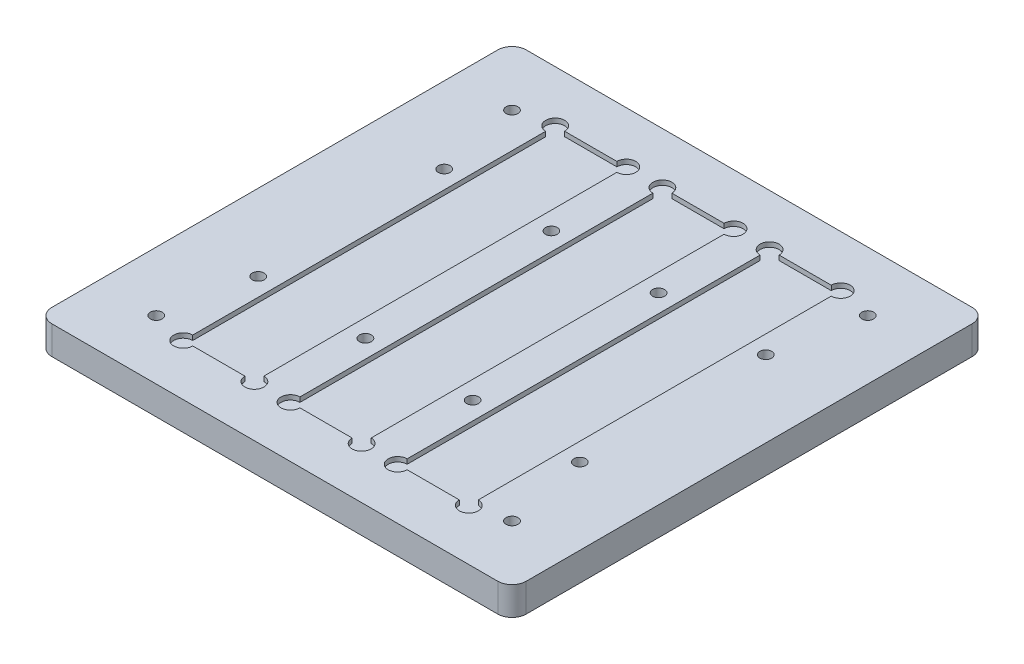
from build123d import *

# Parameters (mm, degrees)
SKETCH1_W             = 100
SKETCH1_H             = 100
BOSS_EXTRUDE1_DEPTH   = 6
SKETCH2_W             = 15
SKETCH2_H             = 78.4
CUT_EXTRUDE1_DEPTH    = 1
M3_TAPPED_HOLE1_D     = 2.5
M3_TAPPED_HOLE1_DEPTH = 4
M3_TAPPED_HOLE1_TIP   = 0.751075774
SKETCH11_R            = 2
CUT_EXTRUDE3_DEPTH    = 1
FILLET2_R             = 3


with BuildPart() as part:
    # Sketch1 → Boss-Extrude1 (new body)
    with BuildSketch(Plane(origin=(0, 0, 0), x_dir=(1, 0, 0), z_dir=(0, 1, 0))):
        Rectangle(SKETCH1_W, SKETCH1_H)
    extrude(amount=BOSS_EXTRUDE1_DEPTH)

    # Sketch2 → Cut-Extrude1 (cut)
    with BuildSketch(Plane(origin=(0, 6, 0), x_dir=(1, 0, 0), z_dir=(0, 1, 0))):
        with Locations((-22.6, 0)):
            Rectangle(SKETCH2_W, SKETCH2_H)
        Rectangle(SKETCH2_W, SKETCH2_H)
        with Locations((22.6, 0)):
            Rectangle(SKETCH2_W, SKETCH2_H)
    extrude(amount=-CUT_EXTRUDE1_DEPTH, mode=Mode.SUBTRACT)

    # M3 Tapped Hole1
    with Locations(Plane(origin=(0, 6, 0), x_dir=(1, 0, 0), z_dir=(0, 1, 0))):
        with Locations((11.3, 19.6), (-33.9, 19.6), (33.9, 19.6), (-37.5, 37.5), (37.5, 37.5), (37.5, -37.5), (-37.5, -37.5), (-33.9, -19.6), (-11.3, -19.6), (11.3, -19.6), (33.9, -19.6), (-11.3, 19.6)):
            Hole(M3_TAPPED_HOLE1_D / 2, depth=M3_TAPPED_HOLE1_DEPTH)
            with Locations((0, 0, -(M3_TAPPED_HOLE1_DEPTH + M3_TAPPED_HOLE1_TIP / 2))):  # 118° drill point
                Cone(0, M3_TAPPED_HOLE1_D / 2, M3_TAPPED_HOLE1_TIP, mode=Mode.SUBTRACT)

    # Sketch11 → Cut-Extrude3 (cut)
    with BuildSketch(Plane(origin=(0, 6, 0), x_dir=(1, 0, 0), z_dir=(0, 1, 0))):
        with Locations((-30.1, 39.2)):
            Circle(SKETCH11_R)
        with Locations((-30.1, -39.2)):
            Circle(SKETCH11_R)
        with Locations((-15.1, -39.2)):
            Circle(SKETCH11_R)
        with Locations((-7.5, -39.2)):
            Circle(SKETCH11_R)
        with Locations((7.5, -39.2)):
            Circle(SKETCH11_R)
        with Locations((15.1, -39.2)):
            Circle(SKETCH11_R)
        with Locations((30.1, -39.2)):
            Circle(SKETCH11_R)
        with Locations((30.1, 39.2)):
            Circle(SKETCH11_R)
        with Locations((7.5, 39.2)):
            Circle(SKETCH11_R)
        with Locations((15.1, 39.2)):
            Circle(SKETCH11_R)
        with Locations((-7.5, 39.2)):
            Circle(SKETCH11_R)
        with Locations((-15.1, 39.2)):
            Circle(SKETCH11_R)
    extrude(amount=-CUT_EXTRUDE3_DEPTH, mode=Mode.SUBTRACT)

    # Fillet2
    fillet2_edges = [part.edges().sort_by_distance(p)[0] for p in [
        (50, 3, 50),
        (-50, 3, 50),
        (-50, 3, -50),
        (50, 3, -50),
    ]]
    fillet(fillet2_edges, radius=FILLET2_R)


solid = part.part
